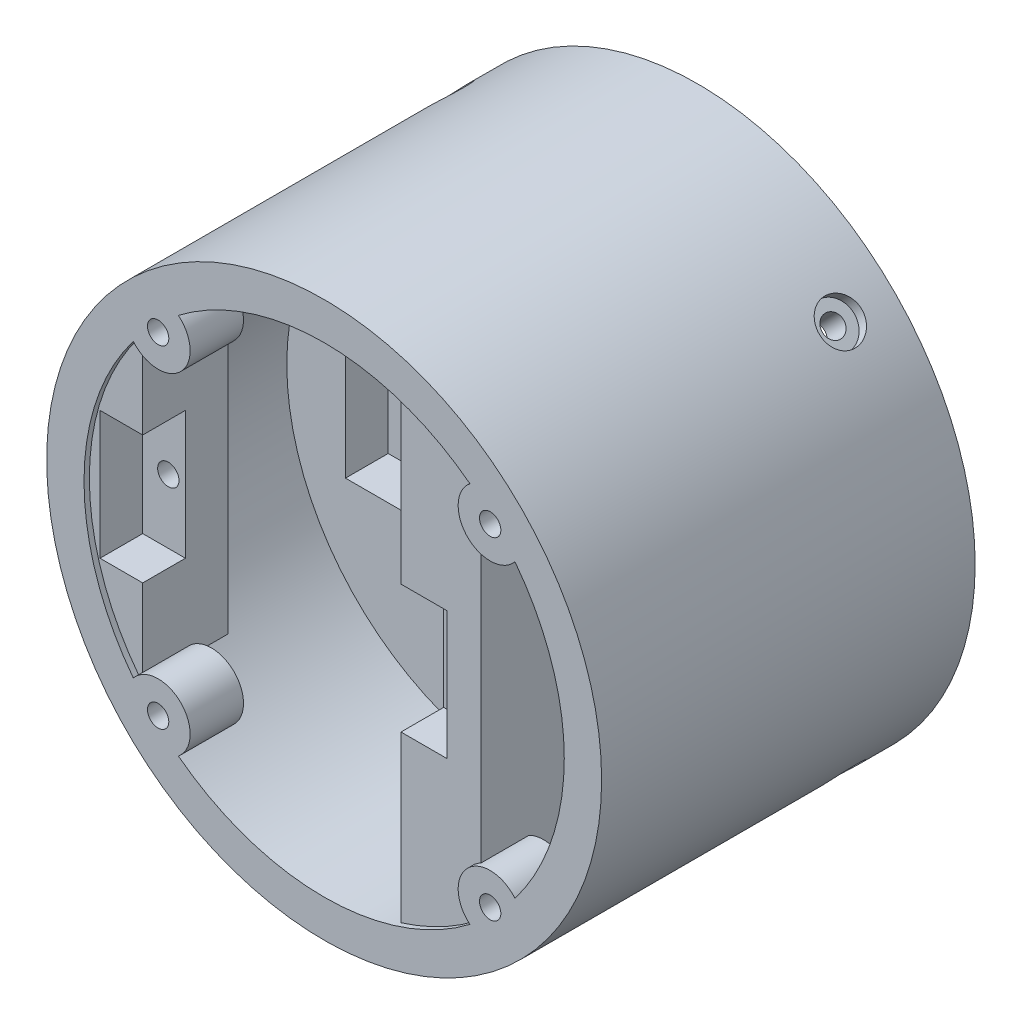
from build123d import *

# Parameters (mm, degrees)
SKETCH_1_R               = 26
EXTRUDE_1_DEPTH          = 35
SKETCH_3_R               = 22.5
CUT_EXTRUDE_1_DEPTH      = 11
CUT_EXTRUDE_START        = -19
SKETCH_4_R               = 22.5
CUT_EXTRUDE_2_DEPTH      = 19
SKETCH_13_W              = 24
SKETCH_13_H              = 13
CUT_EXTRUDE_3_DEPTH      = 4
EXTRUDE_2_DEPTH          = 8
SKETCH_15_W              = 4
SKETCH_15_H              = 12
SKETCH_15_W_2            = 4.3
CUT_EXTRUDE_5_DEPTH      = 4
SKETCH_17_R              = 1
CUT_EXTRUDE_6_DEPTH      = 4
SKETCH_20_R              = 3
EXTRUDE_3_DEPTH          = 5
SKETCH_21_R              = 1
CUT_EXTRUDE_9_DEPTH      = 5
SKETCH_24_W              = 2.5
SKETCH_24_H              = 8
CUT_EXTRUDE_12_DEPTH     = 5
SKETCH_25_R              = 2
CUT_EXTRUDE_13_DEPTH     = 1
SKETCH_26_R              = 1
CUT_EXTRUDE_14_DEPTH     = 71.996321423
PATTERN_CIRCULAR_1_COUNT = 4
CHAMFER_1_SIZE           = 0.5


with BuildPart() as part:
    # Эскиз1 → Бобышка-Вытянуть1 (new body)
    with BuildSketch(Plane.XY):
        Circle(SKETCH_1_R)
    extrude(amount=EXTRUDE_1_DEPTH)

    # Эскиз3 → Вырез-Вытянуть1 (cut)
    with BuildSketch(Plane(origin=(0, 0, 0), x_dir=(-1, 0, 0), z_dir=(0, 0, -1))):
        Circle(SKETCH_3_R)
    extrude(amount=-CUT_EXTRUDE_1_DEPTH, mode=Mode.SUBTRACT)

    # Эскиз4 → Вырез-Вытянуть2 (cut)
    with BuildSketch(Plane.XY.offset(35).offset(CUT_EXTRUDE_START)):
        with Locations(Location((0, 0, 0), (0, 0, 180))):
            Circle(SKETCH_4_R)
    extrude(amount=CUT_EXTRUDE_2_DEPTH, mode=Mode.SUBTRACT)

    # Эскиз13 → Вырез-Вытянуть3 (cut)
    with BuildSketch(Plane.XY.offset(16)):
        with Locations((-5, 0)):
            Rectangle(SKETCH_13_W, SKETCH_13_H)
    extrude(amount=-CUT_EXTRUDE_3_DEPTH, mode=Mode.SUBTRACT)

    # Эскиз14 → Бобышка-Вытянуть2 (add)
    with BuildSketch(Plane.XY.offset(26.5)):
        with BuildLine():
            Line((14.2, -20.575713839), (14.2, 20.575713839))
            ThreePointArc((14.2, 20.575713839), (10.596324929, 22.643274896), (6.7, 24.0854728))
            Line((6.7, 24.0854728), (6.7, -24.0854728))
            ThreePointArc((6.7, -24.0854728), (10.596324929, -22.643274896), (14.2, -20.575713839))
        make_face()
        with BuildLine():
            Line((-17.5, -17.853571071), (-17.5, 17.853571071))
            ThreePointArc((-17.5, 17.853571071), (-25, 0), (-17.5, -17.853571071))
        make_face()
    extrude(amount=EXTRUDE_2_DEPTH)

    # Эскиз15 → Вырез-Вытянуть5 (cut)
    with BuildSketch(Plane.XY.offset(34.5)):
        with Locations((-19.5, 0)):
            Rectangle(SKETCH_15_W, SKETCH_15_H)
        with Locations((8.85, 0)):
            Rectangle(SKETCH_15_W_2, SKETCH_15_H)
    extrude(amount=-CUT_EXTRUDE_5_DEPTH, mode=Mode.SUBTRACT)

    # Эскиз17 → Вырез-Вытянуть6 (cut)
    with BuildSketch(Plane.XY.offset(30.5)):
        with Locations((-19.1, 0)):
            Circle(SKETCH_17_R)
        with Locations((8.6, 0)):
            Circle(SKETCH_17_R)
    extrude(amount=-CUT_EXTRUDE_6_DEPTH, mode=Mode.SUBTRACT)

    # Эскиз20 → Бобышка-Вытянуть3 (add)
    with BuildSketch(Plane.XY.offset(35)):
        with Locations((-15.556349186, 15.556349186)):
            Circle(SKETCH_20_R)
        with Locations((15.556349186, 15.556349186)):
            Circle(SKETCH_20_R)
        with Locations((15.556349186, -15.556349186)):
            Circle(SKETCH_20_R)
        with Locations((-15.556349186, -15.556349186)):
            Circle(SKETCH_20_R)
    extrude(amount=-EXTRUDE_3_DEPTH)

    # Эскиз21 → Вырез-Вытянуть9 (cut)
    with BuildSketch(Plane.XY.offset(35)):
        with Locations((-15.556349186, 15.556349186)):
            Circle(SKETCH_21_R)
        with Locations((15.556349186, 15.556349186)):
            Circle(SKETCH_21_R)
        with Locations((15.556349186, -15.556349186)):
            Circle(SKETCH_21_R)
        with Locations((-15.556349186, -15.556349186)):
            Circle(SKETCH_21_R)
    extrude(amount=-CUT_EXTRUDE_9_DEPTH, mode=Mode.SUBTRACT)

    # Эскиз24 → Вырез-Вытянуть12 (cut)
    with BuildSketch(Plane.XY.offset(16)):
        with Locations((12.25, 0)):
            Rectangle(SKETCH_24_W, SKETCH_24_H)
    extrude(amount=-CUT_EXTRUDE_12_DEPTH, mode=Mode.SUBTRACT)

    # Эскиз25 → Вырез-Вытянуть13 (cut)
    with BuildSketch(Plane(origin=(-18.384776311, -18.384776311, 35), x_dir=(-0.7071067811865678, 0.7071067811865273, 0), z_dir=(-0.7071067811865273, -0.7071067811865678, 0))):
        with Locations(Location((0, 30, 0), (0, 0, 180))):
            Circle(SKETCH_25_R)
    cut_extrude_13 = extrude(amount=-CUT_EXTRUDE_13_DEPTH, mode=Mode.SUBTRACT)

    # Эскиз26 → Вырез-Вытянуть14 (cut, through all)
    with BuildSketch(Plane(origin=(-17.67766953, -17.67766953, 0), x_dir=(0, 0, 1), z_dir=(-0.7071067811865273, -0.7071067811865678, 0))):
        with Locations(Location((5, 0, 0), (0, 0, 270))):
            Circle(SKETCH_26_R)
    cut_extrude_14 = extrude(amount=-CUT_EXTRUDE_14_DEPTH, mode=Mode.SUBTRACT)

    # Круговой массив1: Вырез-Вытянуть13, Вырез-Вытянуть14 ×4 about axis
    pattern_circular_1_axis = Axis((0, 0, 0), (0, 0, 1))
    add([cut_extrude_13.rotate(pattern_circular_1_axis, i * 360 / PATTERN_CIRCULAR_1_COUNT) for i in range(1, PATTERN_CIRCULAR_1_COUNT)], mode=Mode.SUBTRACT)
    add([cut_extrude_14.rotate(pattern_circular_1_axis, i * 360 / PATTERN_CIRCULAR_1_COUNT) for i in range(1, PATTERN_CIRCULAR_1_COUNT)], mode=Mode.SUBTRACT)

    # Фаска1
    chamfer_1_edges = [part.edges().sort_by_distance(p)[0] for p in [
        (22.5, 0, 0),
    ]]
    chamfer(chamfer_1_edges, length=CHAMFER_1_SIZE)


solid = part.part
